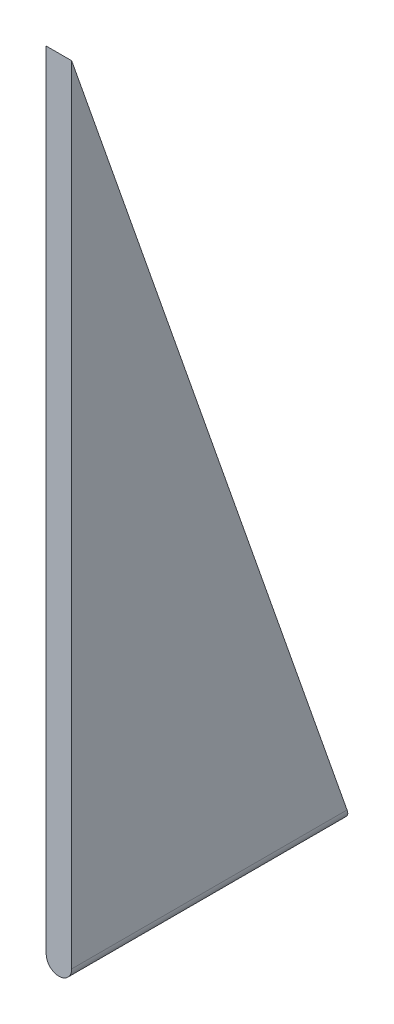
from build123d import *

# Parameters (mm, degrees)
BOSS_EXTRUDE1_DEPTH = 3.175
FILLET2_RADIUS      = 1.5875
FILLET2_LENGTH      = 34.925


with BuildPart() as part:
    # Sketch2 → Boss-Extrude1 (new body)
    with BuildSketch(Plane(origin=(0, 0, 0), x_dir=(0, 0, -1), z_dir=(1, 0, 0))):
        Polygon((0, -41.298475046), (0, 58.460024954), (34.925, -41.298475046), align=None)
    extrude(amount=BOSS_EXTRUDE1_DEPTH)

    # Fillet2: full round fillet: the end face becomes a half cylinder, R = half its width
    fillet2_face = Plane((1.5875, -41.298475046, -17.4625), x_dir=(0, 0, -1), z_dir=(0, -1, 0))  # on the end face: x along it, z out of the body
    fillet2_slab = fillet2_face.offset(-FILLET2_RADIUS / 2) * Box(FILLET2_LENGTH, 2 * FILLET2_RADIUS, FILLET2_RADIUS, mode=Mode.PRIVATE)  # the body's end, R deep
    fillet2_round = Plane((1.5875, -39.710975046, -17.4625), x_dir=(0, -1, 0), z_dir=(0, 0, -1)) * Cylinder(FILLET2_RADIUS, FILLET2_LENGTH, mode=Mode.PRIVATE)  # its axis R under the face
    add(fillet2_slab - fillet2_round, mode=Mode.SUBTRACT)


solid = part.part
